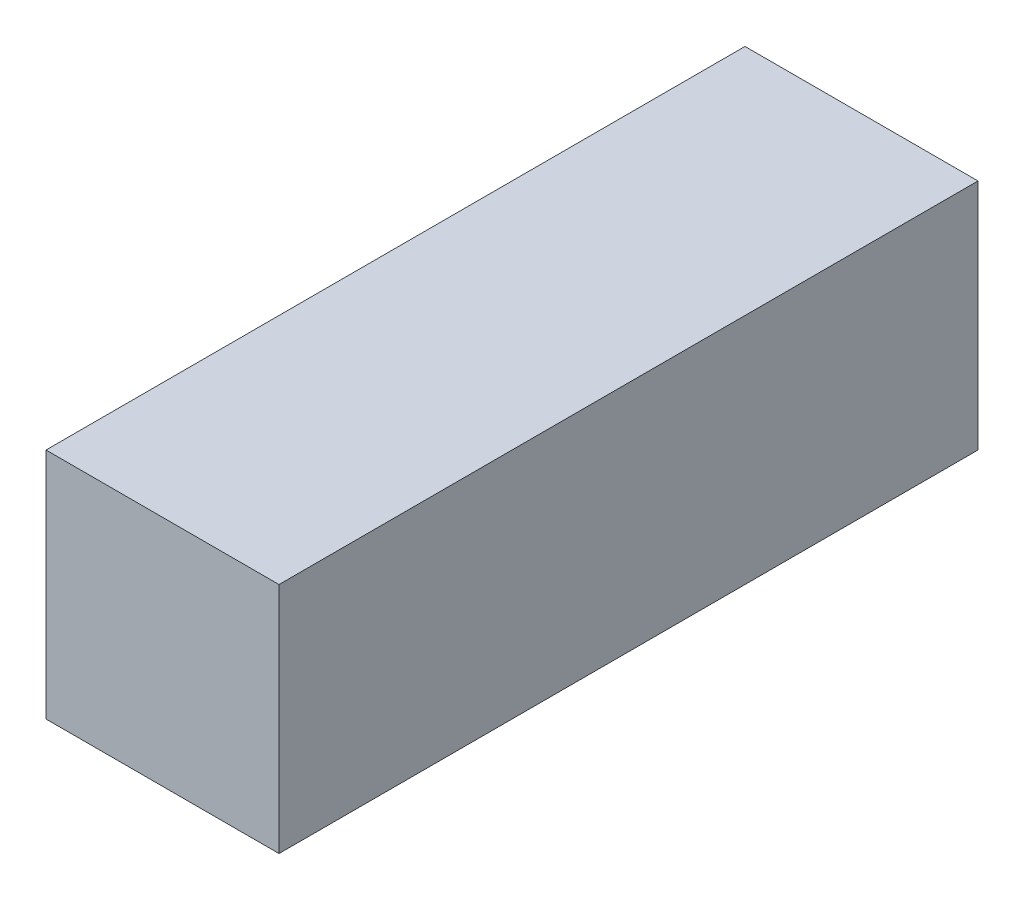
from build123d import *

# Parameters (mm, degrees)
SKETCH1_W           = 4.7625
SKETCH1_H           = 4.7625
BOSS_EXTRUDE1_DEPTH = 7.14375


with BuildPart() as part:
    # Sketch1 → Boss-Extrude1 (new, symmetric)
    with BuildSketch(Plane.XY):
        Rectangle(SKETCH1_W, SKETCH1_H)
    extrude(amount=BOSS_EXTRUDE1_DEPTH, both=True)


solid = part.part
